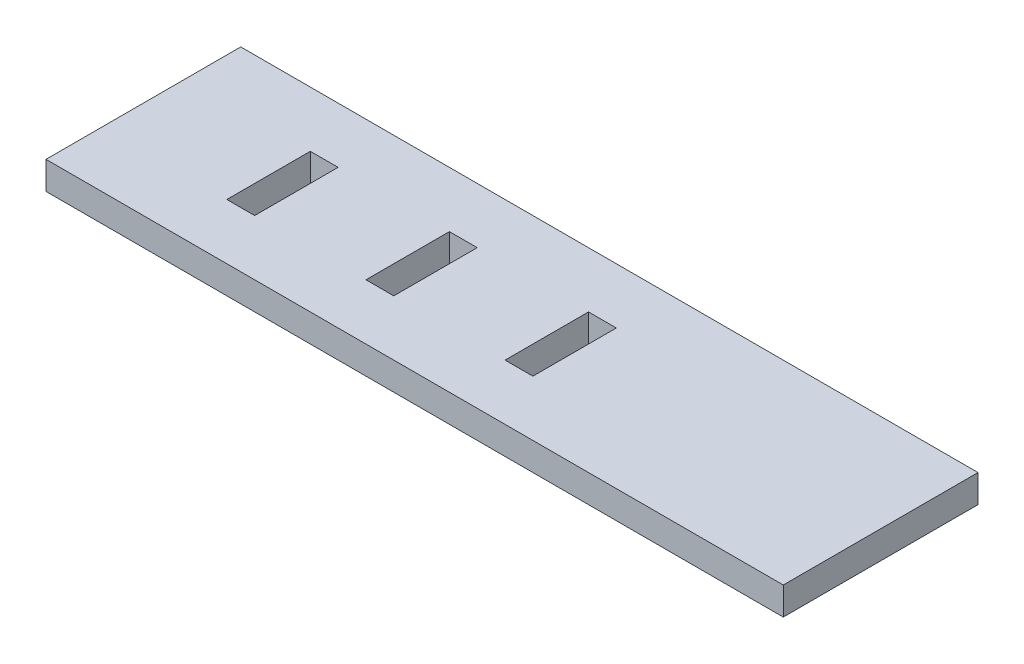
from build123d import *

# Parameters (mm, degrees)
SKETCH1_W           = 265
SKETCH1_H           = 70
SKETCH1_W_2         = 10
SKETCH1_H_2         = 30
BOSS_EXTRUDE1_DEPTH = 10


with BuildPart() as part:
    # Sketch1 → Boss-Extrude1 (new body)
    with BuildSketch(Plane(origin=(0, 0, 0), x_dir=(1, 0, 0), z_dir=(0, 1, 0))):
        with Locations((34.075342466, 8.493150685)):
            Rectangle(SKETCH1_W, SKETCH1_H)
        with Locations((-48.424657534, 8.493150685)):
            Rectangle(SKETCH1_W_2, SKETCH1_H_2, mode=Mode.SUBTRACT)
        with Locations((1.575342466, 8.493150685)):
            Rectangle(SKETCH1_W_2, SKETCH1_H_2, mode=Mode.SUBTRACT)
        with Locations((51.575342466, 8.493150685)):
            Rectangle(SKETCH1_W_2, SKETCH1_H_2, mode=Mode.SUBTRACT)
    extrude(amount=BOSS_EXTRUDE1_DEPTH)


solid = part.part
